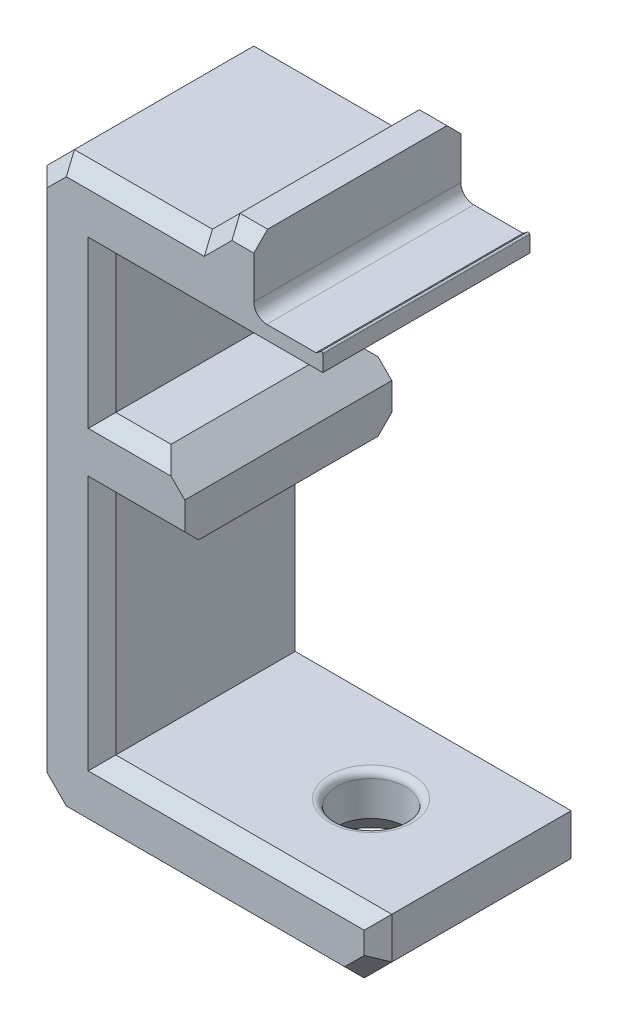
from build123d import *

# Parameters (mm, degrees)
RESSALTO_EXTRUS_O1_DEPTH = 15
ESBO_O3_R                = 2.5
CORTE_EXTRUS_O1_DEPTH    = 15
CHANFRO1_SIZE            = 2
FILETE1_R                = 0.5
FILETE2_R                = 0.94
RESSALTO_EXTRUS_O3_DEPTH = 15
CHANFRO5_SIZE            = 2
CHANFRO4_SIZE            = 1


with BuildPart() as part:
    # Esboço1 → Ressalto-extrusão1 (new body)
    with BuildSketch(Plane.XY):
        with BuildLine():
            Line((11, 14.25), (-5, 14.25))
            Line((-5, 14.25), (-5, 4.25))
            Line((-5, 4.25), (1, 4.25))
            Line((1, 4.25), (1, -0.75))
            Line((1, -0.75), (-5, -0.75))
            Line((-5, -0.75), (-5, -17.25))
            Line((-5, -17.25), (15, -17.25))
            Line((15, -17.25), (15, -22.25))
            Line((15, -22.25), (-10, -22.25))
            Line((-10, -22.25), (-10, 19.25))
            Line((-10, 19.25), (6, 19.25))
            Line((6, 19.25), (6, 16.25))
            Line((6, 16.25), (10.504380809, 16.25))
            ThreePointArc((10.504380809, 16.25), (10.676386068, 16.357306387), (10.826229508, 16.493861918))
            ThreePointArc((10.826229508, 16.493861918), (10.936214298, 16.519561844), (11, 16.426349589))
            Line((11, 16.426349589), (11, 16.25))
            Line((11, 16.25), (11, 14.25))
        make_face()
    extrude(amount=RESSALTO_EXTRUS_O1_DEPTH)

    # Esboço3 → Corte-extrusão1 (cut)
    with BuildSketch(Plane.XZ.offset(22.25)):
        with Locations(Location((7, 7.5, 0), (0, 0, 270))):
            Circle(ESBO_O3_R)
    extrude(amount=-CORTE_EXTRUS_O1_DEPTH, mode=Mode.SUBTRACT)

    # Chanfro1
    chanfro1_edges = [part.edges().sort_by_distance(p)[0] for p in [
        (7, -22.25, 10),
    ]]
    chamfer(chanfro1_edges, length=CHANFRO1_SIZE)

    # Filete1
    filete1_edges = [part.edges().sort_by_distance(p)[0] for p in [
        (7, -17.25, 10),
    ]]
    fillet(filete1_edges, radius=FILETE1_R)

    # Filete2
    filete2_edges = [part.edges().sort_by_distance(p)[0] for p in [
        (6, 16.25, 7.5),
    ]]
    fillet(filete2_edges, radius=FILETE2_R)

    # Esboço5 → Ressalto-extrusão3 (add)
    with BuildSketch(Plane.XY.offset(15)):
        Polygon((6, 19.25), (6, 21.25), (4, 21.25), (2, 19.25), align=None)
    extrude(amount=-RESSALTO_EXTRUS_O3_DEPTH)

    # Chanfro5
    chanfro5_edges = [part.edges().sort_by_distance(p)[0] for p in [
        (15, -22.25, 7.5),
        (-10, -22.25, 7.5),
        (-10, 19.25, 7.5),
        (1, 4.25, 7.5),
    ]]
    chamfer(chanfro5_edges, length=CHANFRO5_SIZE)

    # Chanfro4
    chanfro4_edges = [part.edges().sort_by_distance(p)[0] for p in [
        (-5, 9.25, 15),
        (-2, -0.75, 0),
        (3, 14.25, 15),
        (-5, -9, 0),
        (5, -17.25, 0),
        (3, 14.25, 0),
        (-5, 9.25, 0),
        (11, 14.25, 7.5),
        (5, -17.25, 15),
        (-5, -9, 15),
        (-2, -0.75, 15),
        (-3, 19.25, 0),
        (-3, 19.25, 15),
        (5, 21.25, 15),
        (3, 20.25, 15),
        (3, 20.25, 0),
        (5, 21.25, 0),
        (-3, 4.25, 0),
        (-3, 4.25, 15),
        (15, -18.75, 0),
        (2.5, -22.25, 0),
        (-10, -1.5, 0),
        (-9, 18.25, 0),
        (-9, -21.25, 0),
        (14, -21.25, 0),
        (-10, -1.5, 15),
        (2.5, -22.25, 15),
        (15, -18.75, 15),
        (-9, 18.25, 15),
        (-9, -21.25, 15),
        (14, -21.25, 15),
    ]]
    chamfer(chanfro4_edges, length=CHANFRO4_SIZE)


solid = part.part
